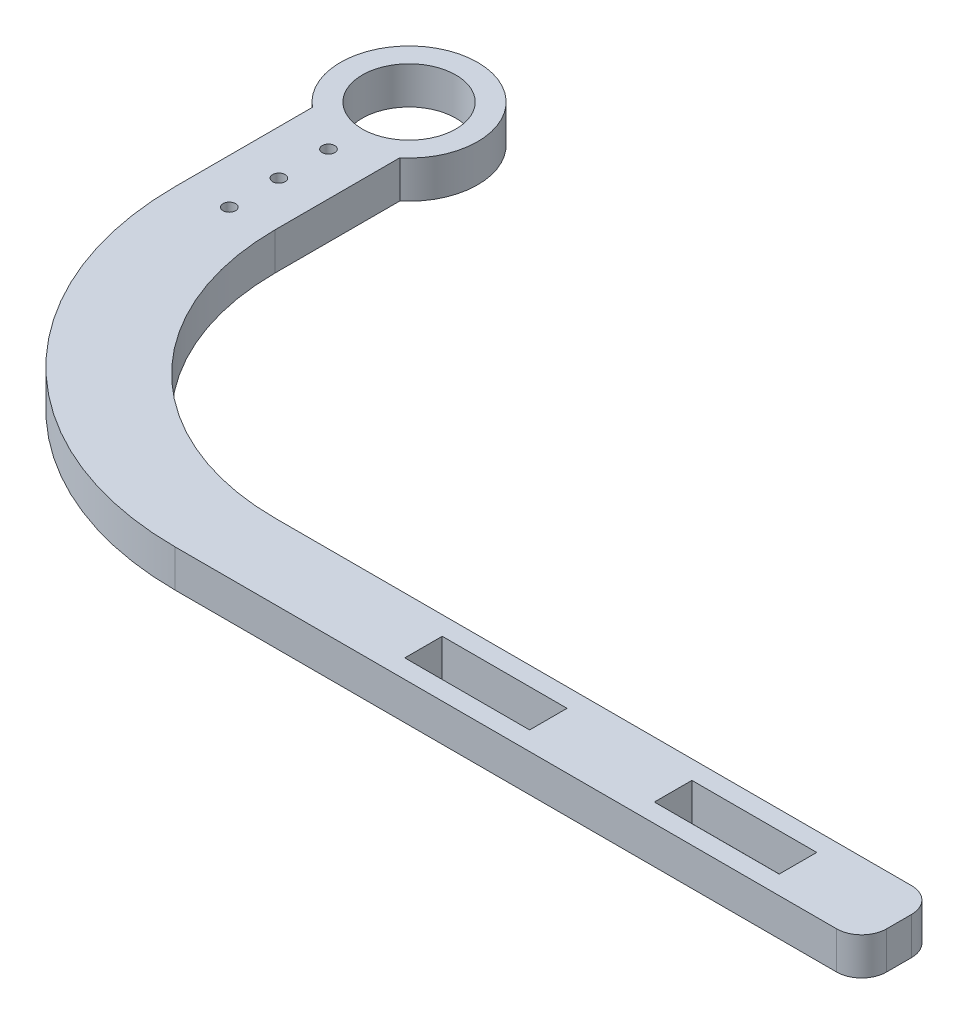
from build123d import *

# Parameters (mm, degrees)
SKETCH1_W           = 100
SKETCH1_H           = 50
BOSS_EXTRUDE1_DEPTH = 3
SKETCH3_W           = 100
SKETCH3_H           = 50
SKETCH3_W_2         = 10
SKETCH3_H_2         = 3.006122746
SKETCH3_H_3         = 3
CUT_EXTRUDE4_DEPTH  = 10
SKETCH4_R           = 1.798549791
CUT_EXTRUDE5_DEPTH  = 10
FILLET1_R           = 20
FILLET2_R           = 25
SKETCH7_R           = 0.5
SKETCH7_R_2         = 3.75
CUT_EXTRUDE7_DEPTH  = 10
FILLET3_R           = 2


with BuildPart() as part:
    # Sketch1 → Boss-Extrude1 (new body)
    with BuildSketch(Plane(origin=(0, 0, 0), x_dir=(1, 0, 0), z_dir=(0, 1, 0))):
        Rectangle(SKETCH1_W, SKETCH1_H)
    extrude(amount=BOSS_EXTRUDE1_DEPTH)

    # Sketch3 → Cut-Extrude4 (cut)
    # profile 1 of 3: a face of its own
    with BuildSketch(Plane(origin=(0, 3, 0), x_dir=(1, 0, 0), z_dir=(0, 1, 0))):
        Rectangle(SKETCH3_W, SKETCH3_H)
        with BuildLine():
            Line((-40.826592013, 13.59041697), (-40.826592013, -16.40958303))
            Line((-40.826592013, -16.40958303), (32.173407987, -16.40958303))
            Line((32.173407987, -16.40958303), (32.173407987, -22.40958303))
            Line((32.173407987, -22.40958303), (-47.826592013, -22.40958303))
            Line((-47.826592013, -22.40958303), (-47.826592013, 13.59041697))
            ThreePointArc((-47.826592013, 13.59041697), (-44.326592013, 23.333057657), (-40.826592013, 13.59041697))
        make_face(mode=Mode.SUBTRACT)
    # profile 2 of 3: a face of its own
    with BuildSketch(Plane(origin=(0, 3, 0), x_dir=(1, 0, 0), z_dir=(0, 1, 0))):
        with Locations((19.073407987, -19.40958303)):
            Rectangle(SKETCH3_W_2, SKETCH3_H_2)
    # profile 3 of 3: a face of its own
    with BuildSketch(Plane(origin=(0, 3, 0), x_dir=(1, 0, 0), z_dir=(0, 1, 0))):
        with Locations((-0.926592013, -19.40958303)):
            Rectangle(SKETCH3_W_2, SKETCH3_H_3)
    extrude(amount=-CUT_EXTRUDE4_DEPTH, mode=Mode.SUBTRACT)

    # Sketch4 → Cut-Extrude5 (cut)
    with BuildSketch(Plane(origin=(0, 3, 0), x_dir=(1, 0, 0), z_dir=(0, 1, 0))):
        with Locations(Location((-44.326592013, 17.833057657, 0), (0, 0, 270))):
            Circle(SKETCH4_R)
    extrude(amount=-CUT_EXTRUDE5_DEPTH, mode=Mode.SUBTRACT)

    # Fillet1
    fillet1_edges = [part.edges().sort_by_distance(p)[0] for p in [
        (-40.826592013, 1.5, 16.40958303),
    ]]
    fillet(fillet1_edges, radius=FILLET1_R)

    # Fillet2
    fillet2_edges = [part.edges().sort_by_distance(p)[0] for p in [
        (-47.826592013, 1.5, 22.40958303),
    ]]
    fillet(fillet2_edges, radius=FILLET2_R)

    # Sketch7 → Cut-Extrude7 (cut)
    with BuildSketch(Plane(origin=(0, 3, 0), x_dir=(1, 0, 0), z_dir=(0, 1, 0))):
        with Locations(Location((-44.283135858, 11.333202923, 0), (0, 0, 270))):
            Circle(SKETCH7_R)
        with Locations(Location((-44.256393609, 7.333292318, 0), (0, 0, 270))):
            Circle(SKETCH7_R)
        with Locations(Location((-44.22965136, 3.333381712, 0), (0, 0, 270))):
            Circle(SKETCH7_R)
        with Locations(Location((-44.326592013, 17.833057657, 0), (0, 0, 270))):
            Circle(SKETCH7_R_2)
    extrude(amount=-CUT_EXTRUDE7_DEPTH, mode=Mode.SUBTRACT)

    # Fillet3
    fillet3_edges = [part.edges().sort_by_distance(p)[0] for p in [
        (32.173407987, 1.5, 22.40958303),
        (32.173407987, 1.5, 16.40958303),
    ]]
    fillet(fillet3_edges, radius=FILLET3_R)


solid = part.part
